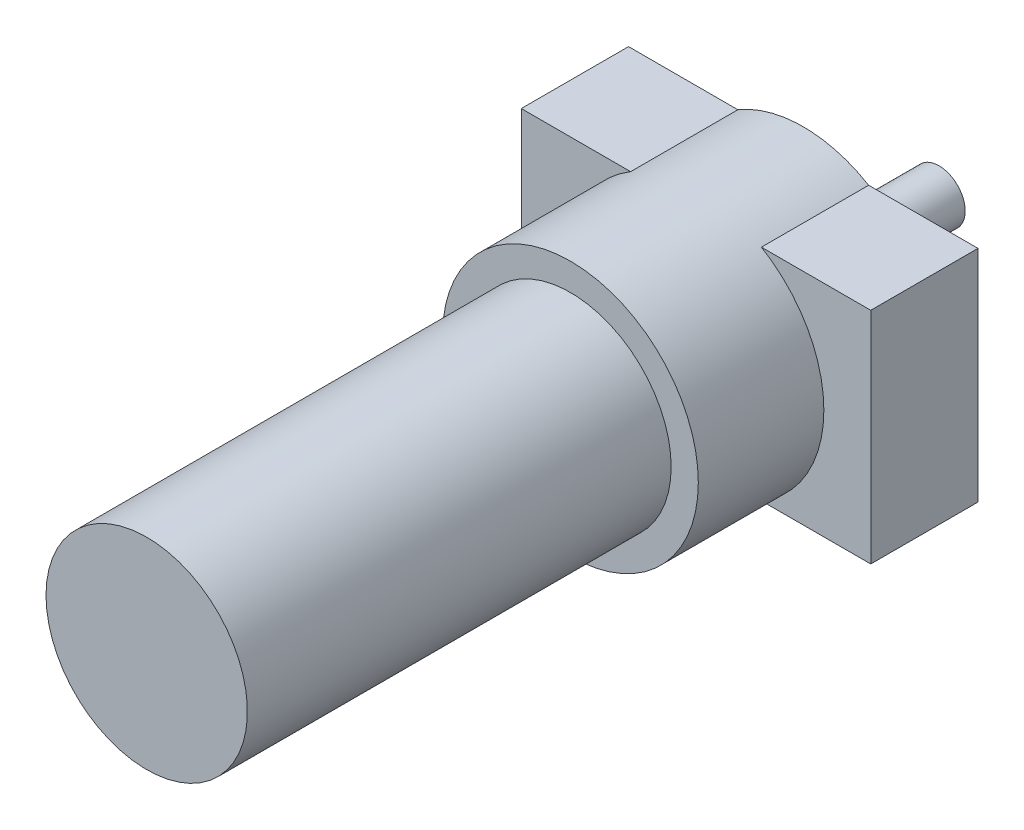
from build123d import *

# Parameters (mm, degrees)
SKETCH_1_R      = 10
EXTRUDE_1_DEPTH = 51.9
SKETCH_2_R      = 48.877397639
EXTRUDE_2_DEPTH = 89
SKETCH_4_W      = 133.6
SKETCH_4_H      = 84
EXTRUDE_4_DEPTH = 41
SKETCH_5_R      = 38.5
EXTRUDE_5_DEPTH = 251


with BuildPart() as part:
    # 草图1 → 凸台-拉伸1 (new body)
    with BuildSketch(Plane.XY):
        with Locations(Location((0, 0, 0), (0, 0, 180))):
            Circle(SKETCH_1_R)
    extrude(amount=EXTRUDE_1_DEPTH)

    # 草图2 → 凸台-拉伸2 (add)
    with BuildSketch(Plane.XY.offset(51.9)):
        Circle(SKETCH_2_R)
    extrude(amount=EXTRUDE_2_DEPTH)

    # 草图4 → 凸台-拉伸4 (add)
    with BuildSketch(Plane(origin=(0, 0, 51.9), x_dir=(-1, 0, 0), z_dir=(0, 0, -1))):
        Rectangle(SKETCH_4_W, SKETCH_4_H)
    extrude(amount=-EXTRUDE_4_DEPTH)

    # 草图5 → 凸台-拉伸5 (add)
    with BuildSketch(Plane(origin=(0, 0, 51.9), x_dir=(-1, 0, 0), z_dir=(0, 0, -1))):
        Circle(SKETCH_5_R)
    extrude(amount=-EXTRUDE_5_DEPTH)


solid = part.part
